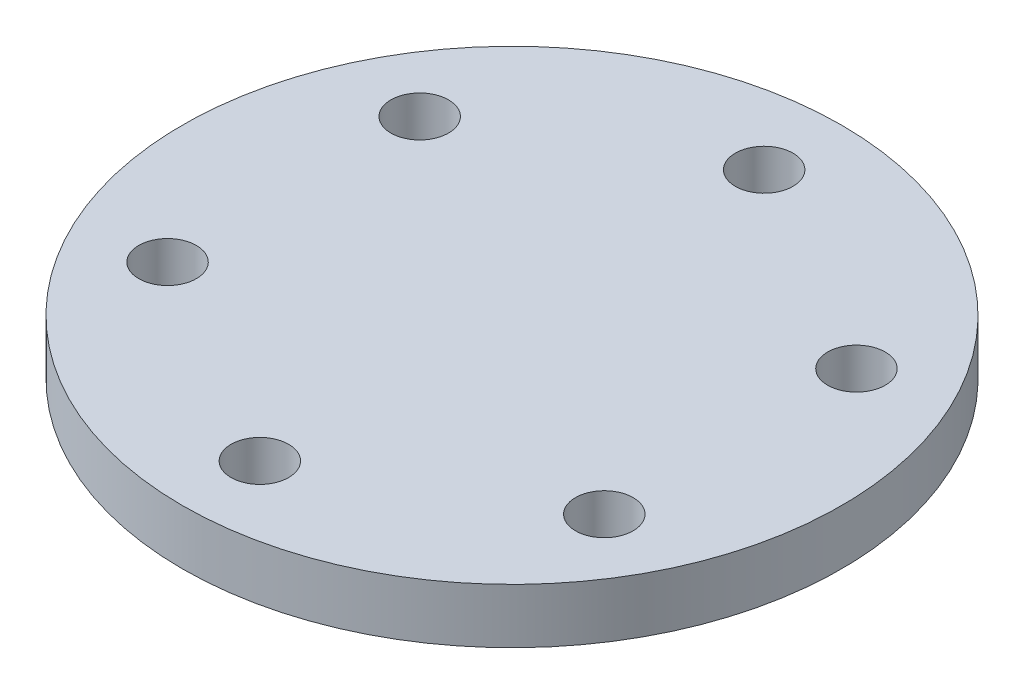
from build123d import *

# Parameters (mm, degrees)
SKETCH1_R           = 60.088817471
BOSS_EXTRUDE1_DEPTH = 10
SKETCH2_R           = 5.255125099
CUT_EXTRUDE1_DEPTH  = 10
CIRPATTERN1_COUNT   = 6


with BuildPart() as part:
    # Sketch1 → Boss-Extrude1 (new body)
    with BuildSketch(Plane(origin=(0, 0, 0), x_dir=(1, 0, 0), z_dir=(0, 1, 0))):
        with Locations(Location((0, 0, 0), (0, 0, 270))):
            Circle(SKETCH1_R)
    extrude(amount=BOSS_EXTRUDE1_DEPTH)

    # Sketch2 → Cut-Extrude1 (cut)
    with BuildSketch(Plane(origin=(0, 0, 0), x_dir=(1, 0, 0), z_dir=(0, 1, 0))):
        with Locations(Location((0, 45.976959249, 0), (0, 0, 270))):
            Circle(SKETCH2_R)
    cut_extrude1 = extrude(amount=CUT_EXTRUDE1_DEPTH, mode=Mode.SUBTRACT)

    # CirPattern1: Cut-Extrude1 ×6 about axis
    cirpattern1_axis = Axis((0, 0, 0), (0, 1, 0))
    for i in range(1, CIRPATTERN1_COUNT):
        add(cut_extrude1.rotate(cirpattern1_axis, i * 360 / CIRPATTERN1_COUNT), mode=Mode.SUBTRACT)


solid = part.part
